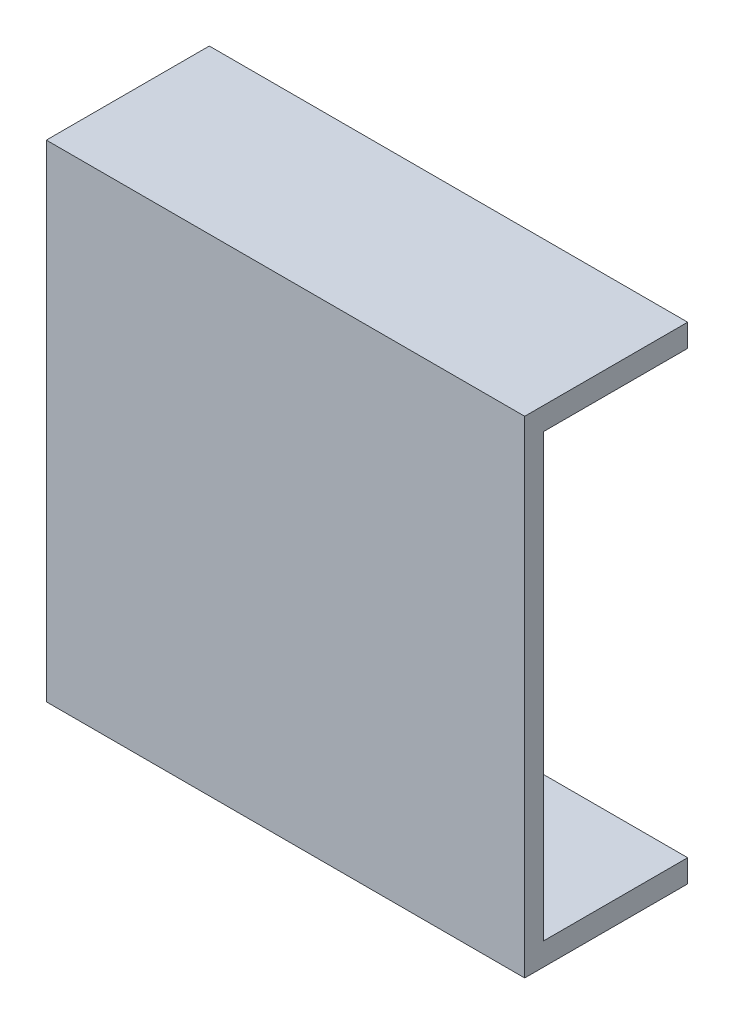
from build123d import *

# Parameters (mm, degrees)
SKETCH_1_W        = 295
SKETCH_1_H        = 300
EXTRUDE_442_DEPTH = 11.5
SKETCH_2_W        = 295
SKETCH_2_H        = 14
EXTRUDE_1_DEPTH   = 89


with BuildPart() as part:
    # 草图1 → Extrude 442 (new body)
    with BuildSketch(Plane.XY):
        with Locations((0, 150)):
            Rectangle(SKETCH_1_W, SKETCH_1_H)
    extrude(amount=EXTRUDE_442_DEPTH)

    # 草图2 → 凸台-拉伸1 (add)
    with BuildSketch(Plane(origin=(0, 0, 0), x_dir=(-1, 0, 0), z_dir=(0, 0, -1))):
        with Locations((0, 293)):
            Rectangle(SKETCH_2_W, SKETCH_2_H)
        with Locations((0, 7)):
            Rectangle(SKETCH_2_W, SKETCH_2_H)
    extrude(amount=EXTRUDE_1_DEPTH)


solid = part.part
